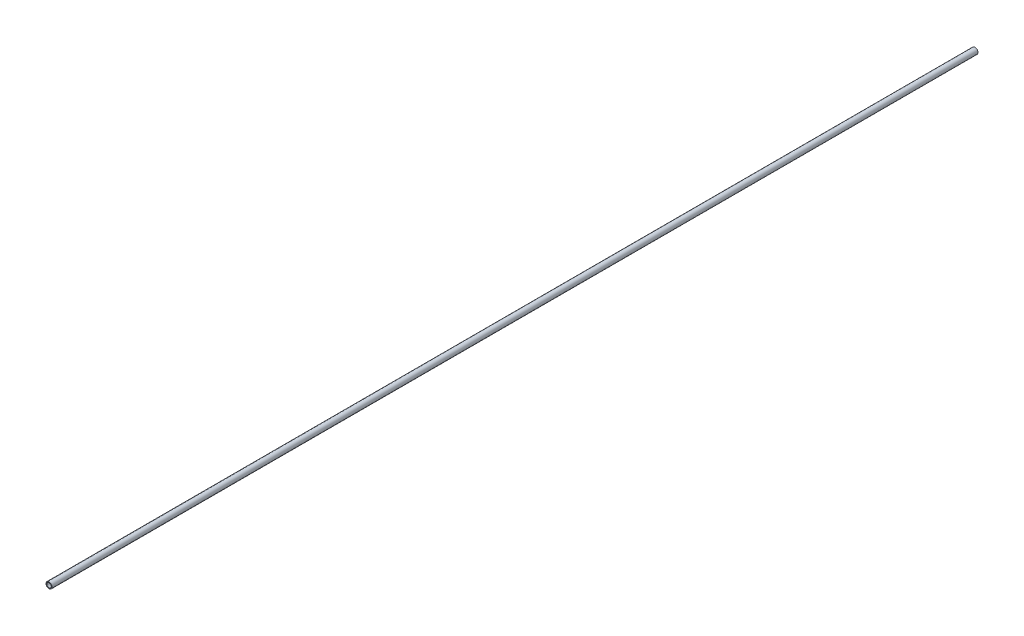
from build123d import *

# Parameters (mm, degrees)
SKETCH_1_R      = 4
SKETCH_1_R_2    = 3
EXTRUDE_1_DEPTH = 1230


with BuildPart() as part:
    # 草图1 → 凸台-拉伸1 (new body)
    with BuildSketch(Plane.XY):
        Circle(SKETCH_1_R)
        Circle(SKETCH_1_R_2, mode=Mode.SUBTRACT)
    extrude(amount=EXTRUDE_1_DEPTH)


solid = part.part
